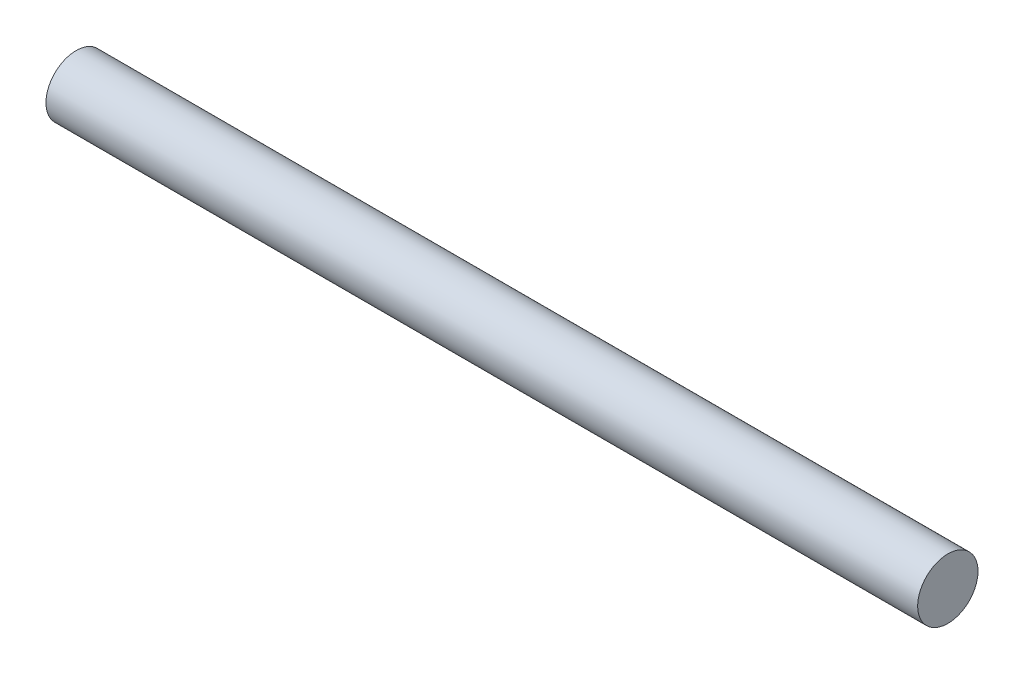
from build123d import *

# Parameters (mm, degrees)
SKETCH1_R           = 25.4
BOSS_EXTRUDE1_DEPTH = 734.314
SCALE1_SCALE        = 0.5867


with BuildPart() as part:
    # Sketch1 → Boss-Extrude1 (new body)
    with BuildSketch(Plane(origin=(0, 0, 0), x_dir=(0, 0, -1), z_dir=(1, 0, 0))):
        Circle(SKETCH1_R)
    extrude(amount=BOSS_EXTRUDE1_DEPTH)


with BuildPart() as part_1:
    # Scale1: scaled about (367.157, 0, 0)
    add(part.part.scale(SCALE1_SCALE).moved(Location((151.7459881, 0, 0))))


solid = part_1.part
